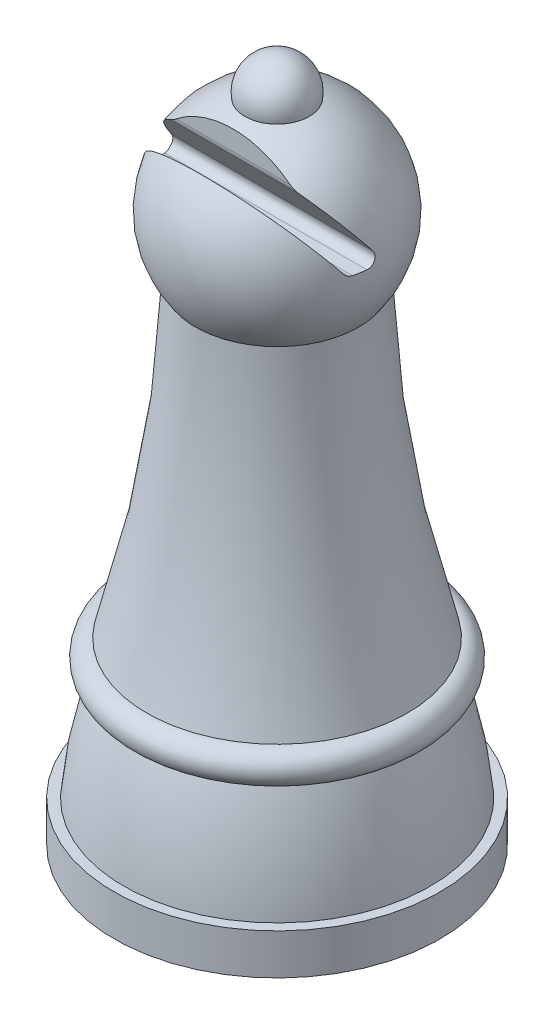
from build123d import *

# Parameters (mm, degrees)
SKETCH4_2_W        = 17.78
SKETCH4_2_H        = 2.54
CUT_EXTRUDE4_DEPTH = 10.795
FILLET1_R          = 0.635


with BuildPart() as part:
    # Sketch1 → Revolve1 (revolve)
    with BuildSketch(Plane.XY, mode=Mode.PRIVATE) as revolve1_sk:
        with BuildLine():
            Line((0, 0), (12.7, 0))
            Line((12.7, 0), (12.7, 3.175))
            Line((12.7, 3.175), (11.938, 3.175))
            ThreePointArc((11.938, 3.175), (11.324664102, 7.361873807), (10.16, 11.43))
            ThreePointArc((10.16, 11.43), (11.43, 12.7), (10.16, 13.97))
            ThreePointArc((10.16, 13.97), (7.508321203, 25.917103348), (6.35, 38.1))
            ThreePointArc((6.35, 38.1), (7.576014134, 45.230603901), (2.507277216, 50.3936))
            ThreePointArc((2.507277216, 50.3936), (1.934406369, 52.446108137), (0, 53.34))
            Line((0, 53.34), (0, 50.8))
            Line((0, 50.8), (0, 0))
        make_face()
    revolve(revolve1_sk.sketch.rotate(Axis((0, 0, 0), (0, 1, 0)), 90), axis=Axis((0, 0, 0), (0, 1, 0)))

    # Sketch4 → Cut-Loft1 section 0
    with BuildSketch(Plane(origin=(0, 48.26, 0), x_dir=(1, 0, 0), z_dir=(0, 1, 0))):
        with BuildLine():
            Line((-8.89, -3.429), (8.89, -3.429))
            Line((8.89, -3.429), (8.89, -5.969))
            Line((8.89, -5.969), (-8.89, -5.969))
            Line((-8.89, -5.969), (-8.89, -3.429))
        make_face()
    # Sketch6 → Cut-Loft1 section 1
    with BuildSketch(Plane(origin=(0, 43.18, 0), x_dir=(1, 0, 0), z_dir=(0, 1, 0))):
        with BuildLine():
            Line((-8.89, -2.159), (8.89, -2.159))
            Line((8.89, -2.159), (8.89, 0.381))
            Line((8.89, 0.381), (-8.89, 0.381))
            Line((-8.89, 0.381), (-8.89, -2.159))
        make_face()
    loft(mode=Mode.SUBTRACT)

    # Sketch4<2> → Cut-Extrude4 (cut)
    with BuildSketch(Plane(origin=(0, 48.26, 0), x_dir=(1, 0, 0), z_dir=(0, 1, 0))):
        with Locations((0, -4.699)):
            Rectangle(SKETCH4_2_W, SKETCH4_2_H)
    extrude(amount=CUT_EXTRUDE4_DEPTH, mode=Mode.SUBTRACT)

    # Fillet1
    fillet1_edges = [part.edges().sort_by_distance(p)[0] for p in [
        (0, 43.18, 2.159),
        (0, 48.26, 3.429),
        (0, 43.18, -0.381),
    ]]
    fillet(fillet1_edges, radius=FILLET1_R)


solid = part.part
